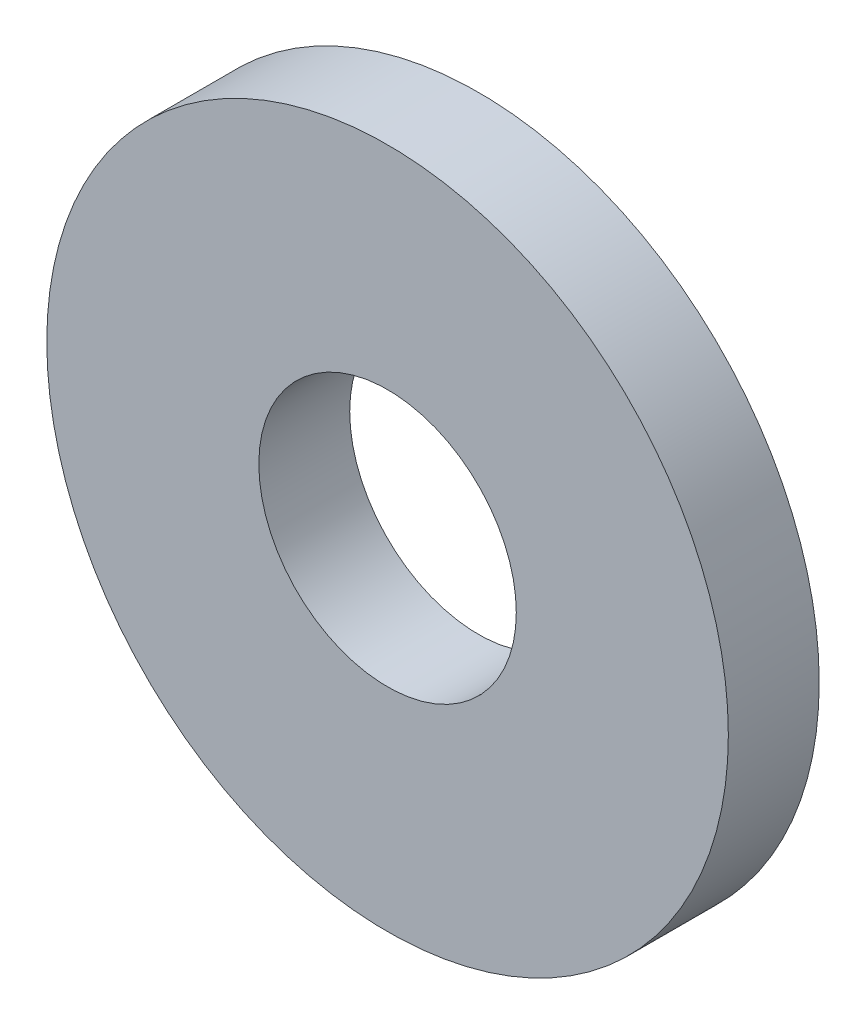
from build123d import *

# Parameters (mm, degrees)
F_0102_CYLINDER_SKETCH_R = 4.5
F_0102_CYLINDER_DEPTH    = 1.2
F_0104_CYLINDER_SKETCH_R = 1.7
F_0104_CYLINDER_DEPTH    = 2


with BuildPart() as part:
    # 0102_cylinder_Sketch → 0102_cylinder (new body)
    with BuildSketch(Plane.XY):
        Circle(F_0102_CYLINDER_SKETCH_R)
    extrude(amount=F_0102_CYLINDER_DEPTH)


with BuildPart() as part_1:
    # 0102_cylinder_Translate: moved
    add(part.part.moved(Location((0, 0, -36.7))))


with BuildPart() as body_2:
    # 0104_cylinder_Sketch → 0104_cylinder (new body)
    with BuildSketch(Plane.XY):
        Circle(F_0104_CYLINDER_SKETCH_R)
    extrude(amount=F_0104_CYLINDER_DEPTH)


with BuildPart() as body_2_1:
    # 0104_cylinder_Translate: moved
    add(body_2.part.moved(Location((0, 0, -37))))


with BuildPart() as part_2:
    add(part_1.part)

    # 0106_sub: cut body 2
    add(body_2_1.part, mode=Mode.SUBTRACT)


solid = part_2.part
